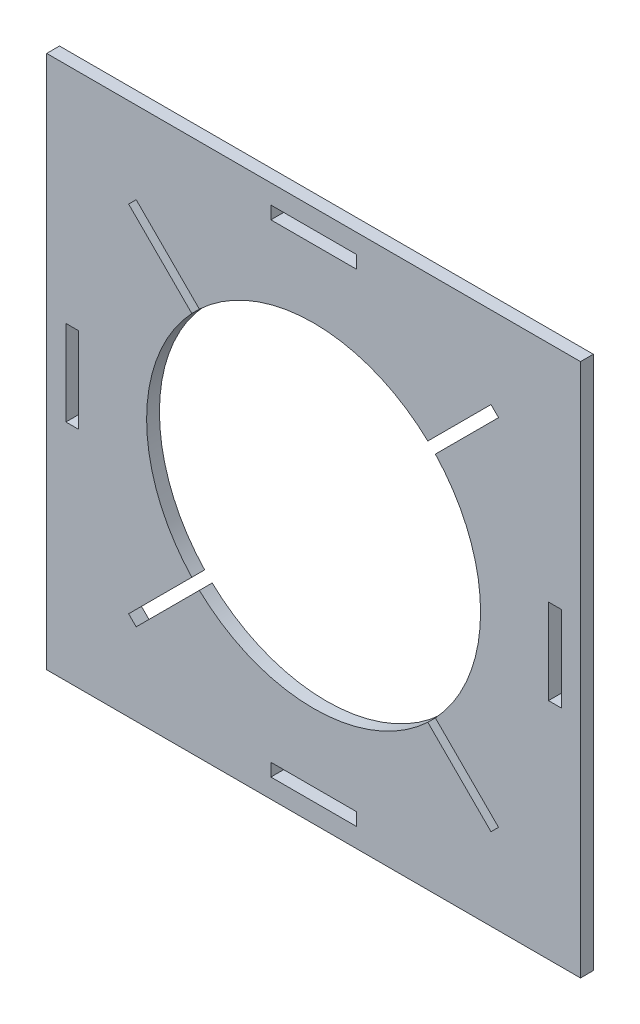
from build123d import *

# Parameters (mm, degrees)
SKETCH1_W           = 250
SKETCH1_H           = 250
BOSS_EXTRUDE1_DEPTH = 6
SKETCH2_R           = 78.2
CUT_EXTRUDE1_DEPTH  = 177.878489365
CUT_EXTRUDE2_DEPTH  = 177.878489365
CIRPATTERN1_COUNT   = 4
SKETCH4_W           = 40
SKETCH4_H           = 6
CUT_EXTRUDE3_DEPTH  = 177.878489365
CIRPATTERN2_COUNT   = 4


with BuildPart() as part:
    # Sketch1 → Boss-Extrude1 (new body)
    with BuildSketch(Plane.XY):
        Rectangle(SKETCH1_W, SKETCH1_H)
    extrude(amount=BOSS_EXTRUDE1_DEPTH)

    # Sketch2 → Cut-Extrude1 (cut, through all)
    with BuildSketch(Plane.XY.offset(6)):
        Circle(SKETCH2_R)
    extrude(amount=-CUT_EXTRUDE1_DEPTH, mode=Mode.SUBTRACT)

    # Sketch3 → Cut-Extrude2 (cut, through all)
    with BuildSketch(Plane.XY.offset(6)):
        with BuildLine():
            Line((-57.035252874, 53.499718968), (-86.620580695, 83.085046789))
            Line((-86.620580695, 83.085046789), (-83.085046789, 86.620580695))
            Line((-83.085046789, 86.620580695), (-53.499718968, 57.035252874))
            ThreePointArc((-53.499718968, 57.035252874), (-55.295750289, 55.295750289), (-57.035252874, 53.499718968))
        make_face()
    cut_extrude2 = extrude(amount=-CUT_EXTRUDE2_DEPTH, mode=Mode.SUBTRACT)

    # CirPattern1: Cut-Extrude2 ×4 about axis
    cirpattern1_axis = Axis((0, 0, -0.3), (0, 0, 1))
    for i in range(1, CIRPATTERN1_COUNT):
        add(cut_extrude2.rotate(cirpattern1_axis, i * 360 / CIRPATTERN1_COUNT), mode=Mode.SUBTRACT)

    # Sketch4 → Cut-Extrude3 (cut, through all)
    with BuildSketch(Plane.XY.offset(6)):
        with Locations((0, 113)):
            Rectangle(SKETCH4_W, SKETCH4_H)
    cut_extrude3 = extrude(amount=-CUT_EXTRUDE3_DEPTH, mode=Mode.SUBTRACT)

    # CirPattern2: Cut-Extrude3 ×4 about axis
    cirpattern2_axis = Axis((0, 0, -0.3), (0, 0, 1))
    for i in range(1, CIRPATTERN2_COUNT):
        add(cut_extrude3.rotate(cirpattern2_axis, i * 360 / CIRPATTERN2_COUNT), mode=Mode.SUBTRACT)


solid = part.part
